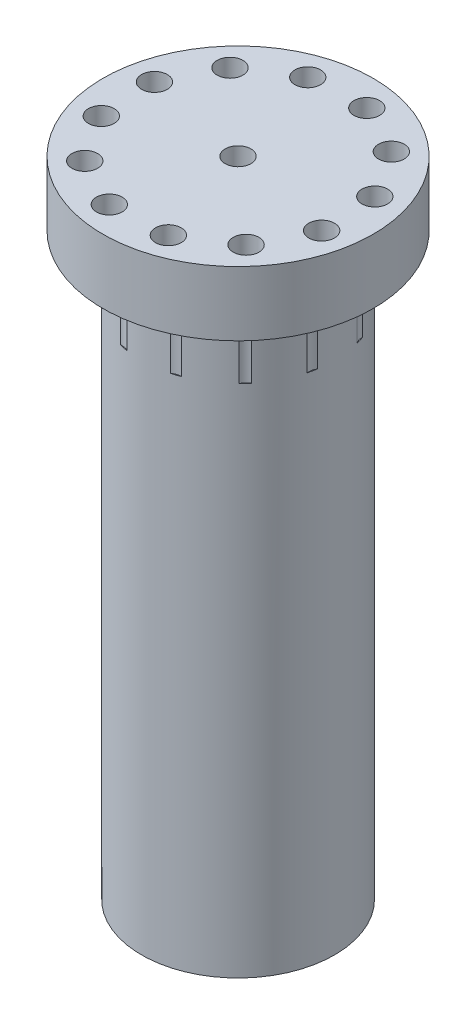
from build123d import *

# Parameters (mm, degrees)
SKETCH2_R          = 1
CUT_EXTRUDE1_DEPTH = 10
SKETCH3_R          = 3
CUT_EXTRUDE3_DEPTH = 10
SKETCH4_R          = 1
CUT_EXTRUDE4_DEPTH = 53.158412553


with BuildPart() as part:
    # Sketch1 → Revolve1 (revolve)
    with BuildSketch(Plane.XY, mode=Mode.PRIVATE) as revolve1_sk:
        Polygon((0, 0), (0, 3), (4.1, 3), (4.1, 18), (0, 18), (0, 50), (7.5, 50), (10.5, 50), (10.5, 45), (7.5, 45), (7.5, 0), align=None)
    revolve(revolve1_sk.sketch.rotate(Axis((0, 18, 0), (0, 1, 0)), 90), axis=Axis((0, 18, 0), (0, 1, 0)))

    # Sketch2 → Cut-Extrude1 (cut)
    with BuildSketch(Plane(origin=(0, 50, 0), x_dir=(1, 0, 0), z_dir=(0, 1, 0))):
        with Locations(Location((-2.60602925, 8.021687752, 0), (0, 0, 180))):
            Circle(SKETCH2_R)
        with Locations(Location((1.753956343, 8.25, 0), (0, 0, 180))):
            Circle(SKETCH2_R)
        with Locations(Location((5.64397075, 6.26773141, 0), (0, 0, 180))):
            Circle(SKETCH2_R)
        with Locations(Location((8.021687752, 2.60602925, 0), (0, 0, 180))):
            Circle(SKETCH2_R)
        with Locations(Location((8.25, -1.753956343, 0), (0, 0, 180))):
            Circle(SKETCH2_R)
        with Locations(Location((6.26773141, -5.64397075, 0), (0, 0, 180))):
            Circle(SKETCH2_R)
        with Locations(Location((2.60602925, -8.021687752, 0), (0, 0, 180))):
            Circle(SKETCH2_R)
        with Locations(Location((-1.753956343, -8.25, 0), (0, 0, 180))):
            Circle(SKETCH2_R)
        with Locations(Location((-5.64397075, -6.26773141, 0), (0, 0, 180))):
            Circle(SKETCH2_R)
        with Locations(Location((-8.021687752, -2.60602925, 0), (0, 0, 180))):
            Circle(SKETCH2_R)
        with Locations(Location((-8.25, 1.753956343, 0), (0, 0, 180))):
            Circle(SKETCH2_R)
        with Locations(Location((-6.26773141, 5.64397075, 0), (0, 0, 180))):
            Circle(SKETCH2_R)
    extrude(amount=-CUT_EXTRUDE1_DEPTH, mode=Mode.SUBTRACT)

    # Sketch3 → Cut-Extrude3 (cut)
    with BuildSketch(Plane.XZ):
        Circle(SKETCH3_R)
    extrude(amount=-CUT_EXTRUDE3_DEPTH, mode=Mode.SUBTRACT)

    # Sketch4 → Cut-Extrude4 (cut, through all)
    with BuildSketch(Plane(origin=(0, 50, 0), x_dir=(1, 0, 0), z_dir=(0, 1, 0))):
        with Locations(Location((0, 0, 0), (0, 0, 270))):
            Circle(SKETCH4_R)
    extrude(amount=-CUT_EXTRUDE4_DEPTH, mode=Mode.SUBTRACT)


solid = part.part
